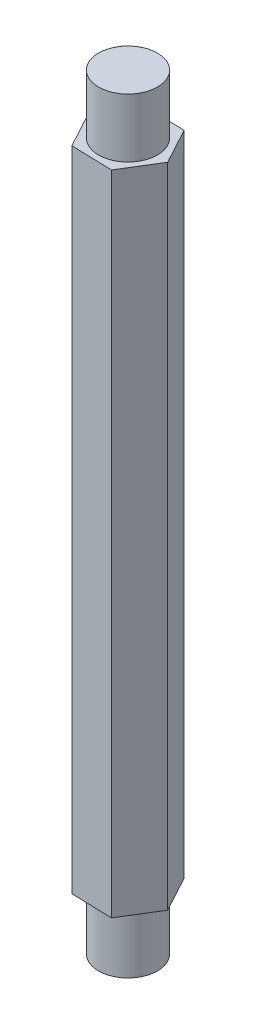
from build123d import *

# Parameters (mm, degrees)
SKETCH1_R           = 1.5
BOSS_EXTRUDE1_DEPTH = 3
BOSS_EXTRUDE2_DEPTH = 33
SKETCH3_R           = 1.5
BOSS_EXTRUDE3_DEPTH = 3


with BuildPart() as part:
    # Sketch1 → Boss-Extrude1 (new body)
    with BuildSketch(Plane(origin=(0, 0, 0), x_dir=(1, 0, 0), z_dir=(0, 1, 0))):
        with Locations(Location((0, 0, 0), (0, 0, 270))):
            Circle(SKETCH1_R)
    extrude(amount=BOSS_EXTRUDE1_DEPTH)

    # Sketch2 → Boss-Extrude2 (add)
    with BuildSketch(Plane(origin=(0, 3, 0), x_dir=(1, 0, 0), z_dir=(0, 1, 0))):
        Polygon((-0.98915483, 1.827996915), (-2.077669182, 0.057365247), (-1.088514352, -1.770631668), (0.98915483, -1.827996915), (2.077669182, -0.057365247), (1.088514352, 1.770631668), align=None)
    extrude(amount=BOSS_EXTRUDE2_DEPTH)

    # Sketch3 → Boss-Extrude3 (add)
    with BuildSketch(Plane(origin=(0, 36, 0), x_dir=(1, 0, 0), z_dir=(0, 1, 0))):
        with Locations(Location((0, 0, 0), (0, 0, 270))):
            Circle(SKETCH3_R)
    extrude(amount=BOSS_EXTRUDE3_DEPTH)


solid = part.part
